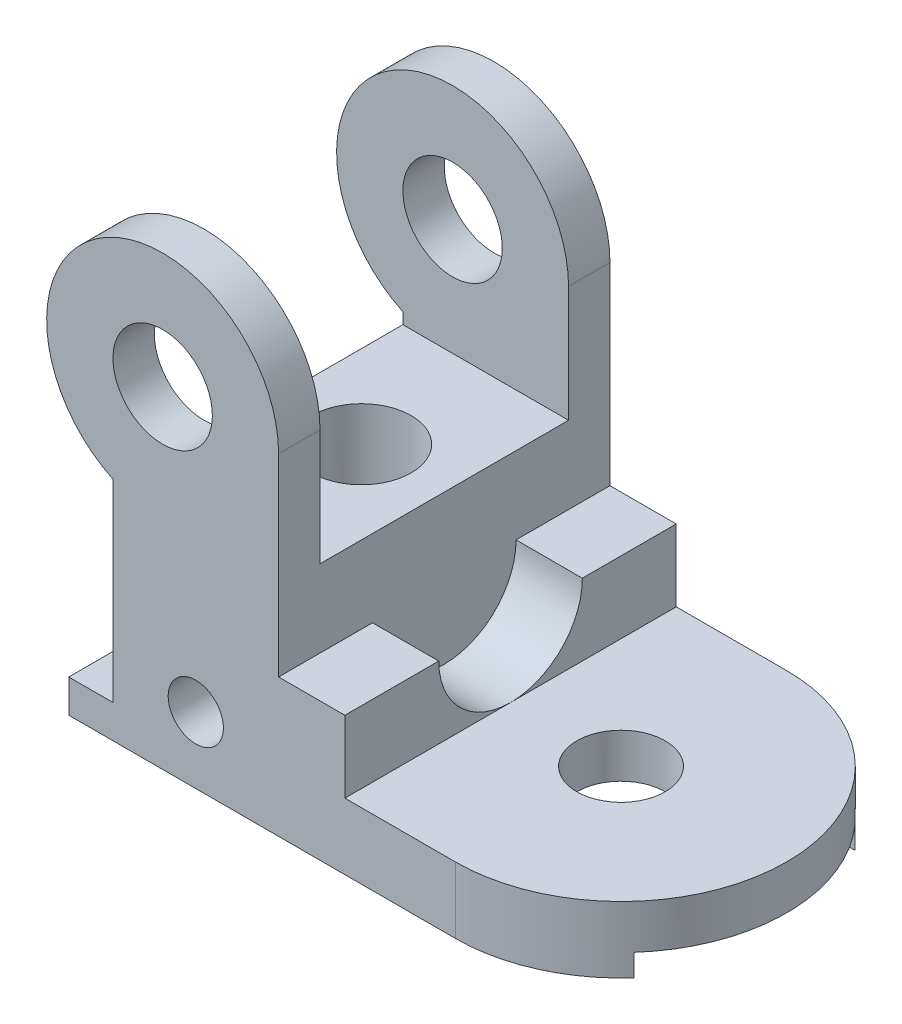
from build123d import *

# Parameters (mm, degrees)
SKETCH1_R               = 9
SKETCH1_R_2             = 5
BOSS_EXTRUDE1_DEPTH     = 30
SKETCH2_W               = 45
SKETCH2_H               = 42
CUT_EXTRUDE2_DEPTH      = 107.324973548
CUT_EXTRUDE3_DEPTH      = 60
CUT_EXTRUDE4_DEPTH      = 113.534439173
CUT_EXTRUDE4_DEPTH_BACK = 113.534439173
SKETCH4_R               = 9
SKETCH4_R_2             = 8
SKETCH5_R               = 13
CUT_EXTRUDE5_DEPTH      = 12
SKETCH6_W               = 40
SKETCH6_H               = 4
CUT_EXTRUDE6_DEPTH      = 133.140077214


with BuildPart() as part:
    # Sketch1 → Boss-Extrude1 (new, symmetric)
    with BuildSketch(Plane.XY):
        with BuildLine():
            Line((0, 0), (0, 6))
            Line((0, 6), (8, 6))
            Line((8, 6), (8, 41.026334039))
            ThreePointArc((8, 41.026334039), (5.77502784, 77.748239349), (38, 60))
            Line((38, 60), (38, 25))
            Line((38, 25), (50, 25))
            Line((50, 25), (50, 12))
            Line((50, 12), (100, 12))
            Line((100, 12), (100, 0))
            Line((100, 0), (0, 0))
        make_face()
        with Locations((17, 60)):
            Circle(SKETCH1_R, mode=Mode.SUBTRACT)
        with Locations((23, 12)):
            Circle(SKETCH1_R_2, mode=Mode.SUBTRACT)
    extrude(amount=BOSS_EXTRUDE1_DEPTH, both=True)

    # Sketch2 → Cut-Extrude2 (cut, through all)
    with BuildSketch(Plane(origin=(38, 0, 0), x_dir=(0, 0, -1), z_dir=(1, 0, 0))):
        with Locations((0, 60)):
            Rectangle(SKETCH2_W, SKETCH2_H)
    extrude(amount=-CUT_EXTRUDE2_DEPTH, mode=Mode.SUBTRACT)

    # Sketch3 → Cut-Extrude3 (cut)
    with BuildSketch(Plane(origin=(0, 12, 0), x_dir=(1, 0, 0), z_dir=(0, 1, 0))):
        with BuildLine():
            ThreePointArc((70, 30), (91.213203436, 21.213203436), (100, 0))
            Line((100, 0), (100, 30))
            Line((100, 30), (70, 30))
        make_face()
        with BuildLine():
            Line((100, -30), (100, 0))
            ThreePointArc((100, 0), (91.213203436, -21.213203436), (70, -30))
            Line((70, -30), (100, -30))
        make_face()
    extrude(amount=-CUT_EXTRUDE3_DEPTH, mode=Mode.SUBTRACT)

    # Sketch4 → Cut-Extrude4 (cut, two sides: drawn at the far end of the back side and taken through both)
    with BuildSketch(Plane(origin=(0, 39, 0), x_dir=(1, 0, 0), z_dir=(0, 1, 0)).offset(-CUT_EXTRUDE4_DEPTH_BACK)):
        with Locations(Location((23, 0, 0), (0, 0, 180))):
            Circle(SKETCH4_R)
        with Locations(Location((70, 0, 0), (0, 0, 180))):
            Circle(SKETCH4_R_2)
    extrude(amount=CUT_EXTRUDE4_DEPTH + CUT_EXTRUDE4_DEPTH_BACK, mode=Mode.SUBTRACT)

    # Sketch5 → Cut-Extrude5 (cut)
    with BuildSketch(Plane(origin=(50, 0, 0), x_dir=(0, 0, -1), z_dir=(1, 0, 0))):
        with Locations((0, 25)):
            Circle(SKETCH5_R)
    extrude(amount=-CUT_EXTRUDE5_DEPTH, mode=Mode.SUBTRACT)

    # Sketch6 → Cut-Extrude6 (cut, through all)
    with BuildSketch(Plane.ZY):
        with Locations((0, 2)):
            Rectangle(SKETCH6_W, SKETCH6_H)
    extrude(amount=-CUT_EXTRUDE6_DEPTH, mode=Mode.SUBTRACT)


solid = part.part
